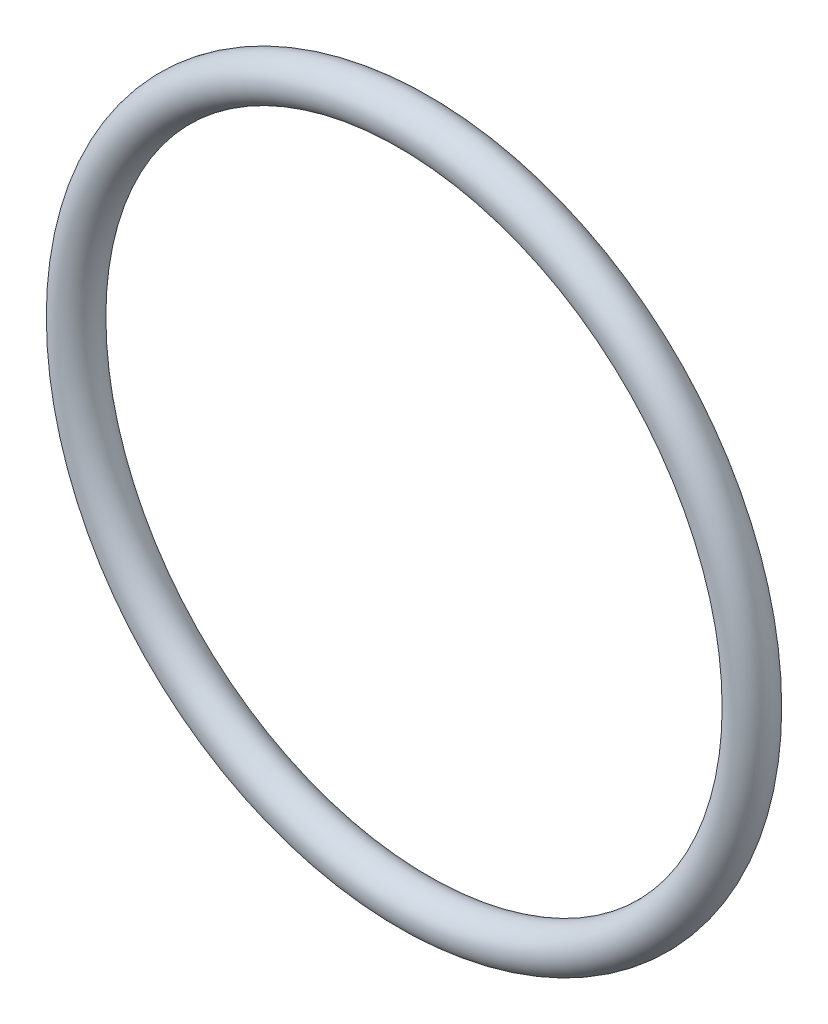
from build123d import *

# Parameters (mm, degrees)
SKETCH1_R = 1.3081


with BuildPart() as part:
    # Sketch1 → Revolve1 (revolve)
    with BuildSketch(Plane(origin=(0, 0, 0), x_dir=(0, -1, 0), z_dir=(1, 0, 0))):
        with Locations((20.9804, 0)):
            Circle(SKETCH1_R)
    revolve(axis=Axis((0, 0, 1.3081), (0, 0, -1)))


solid = part.part
